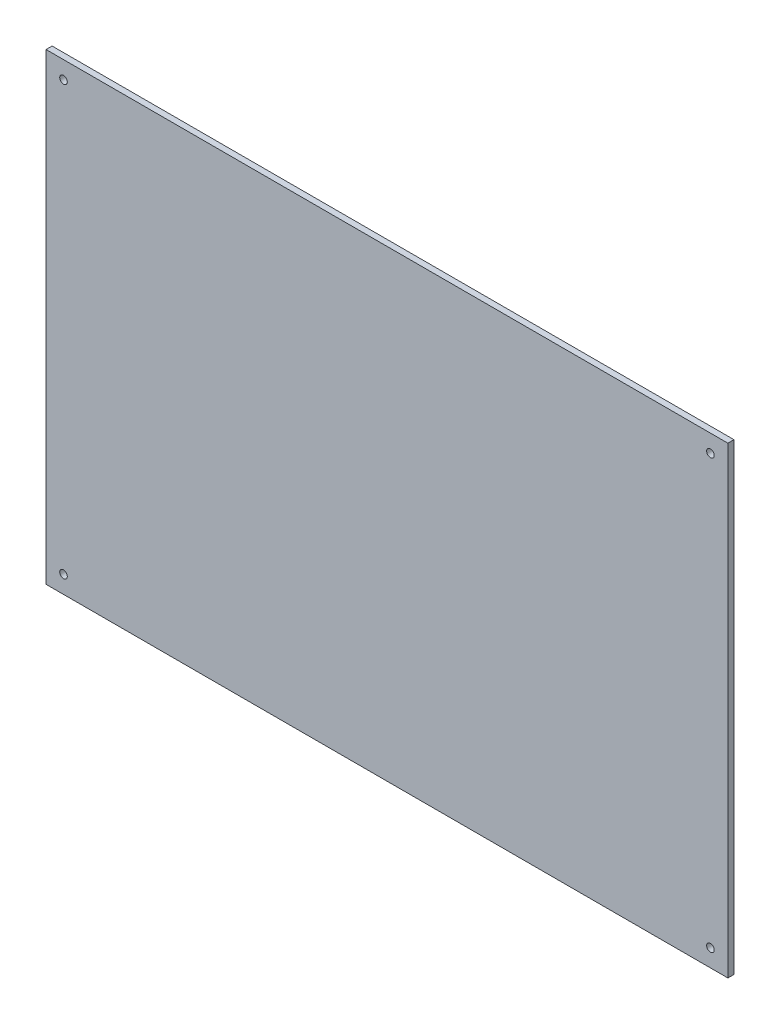
from build123d import *

# Parameters (mm, degrees)
SCHIZZO1_W                   = 449
SCHIZZO1_H                   = 305
SCHIZZO1_R                   = 2.5
ESTRUSIONE_ESTRUSIONE1_DEPTH = 4


with BuildPart() as part:
    # Schizzo1 → Estrusione-Estrusione1 (new body)
    with BuildSketch(Plane.XY):
        with Locations((-224.5, 152.5)):
            Rectangle(SCHIZZO1_W, SCHIZZO1_H)
        with Locations((-437.5, 293.5)):
            Circle(SCHIZZO1_R, mode=Mode.SUBTRACT)
        with Locations(Location((-11.5, 293.5, 0), (0, 0, 180))):
            Circle(SCHIZZO1_R, mode=Mode.SUBTRACT)
        with Locations(Location((-437.5, 11.5, 0), (0, 0, 180))):
            Circle(SCHIZZO1_R, mode=Mode.SUBTRACT)
        with Locations((-11.5, 11.5)):
            Circle(SCHIZZO1_R, mode=Mode.SUBTRACT)
    extrude(amount=ESTRUSIONE_ESTRUSIONE1_DEPTH)


solid = part.part
